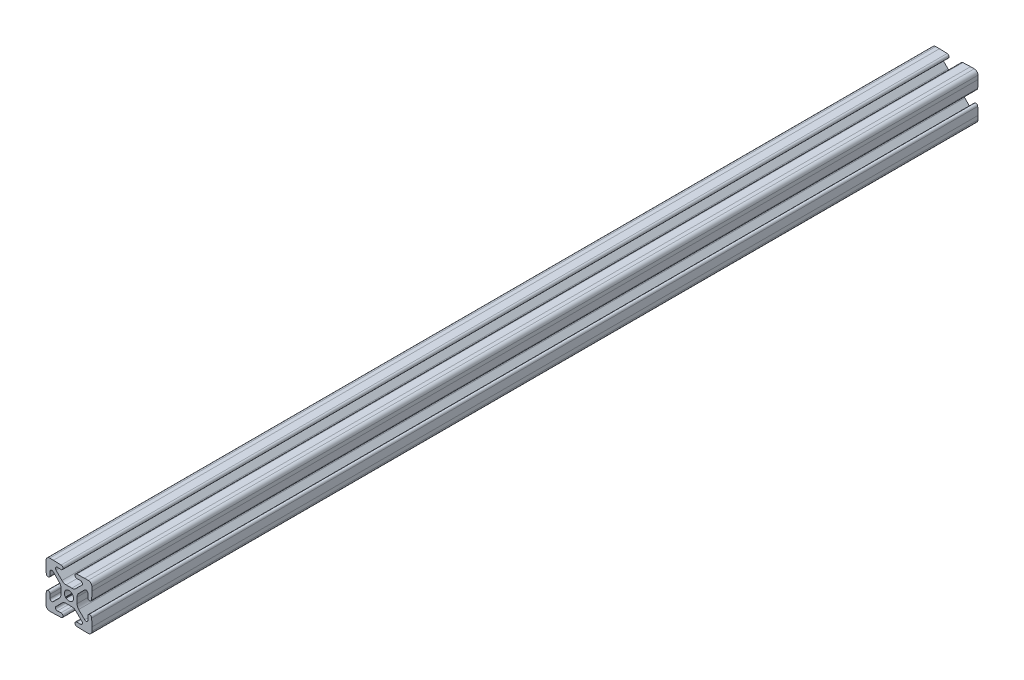
from build123d import *

# Parameters (mm, degrees)
BOSS_EXTRUDE1_DEPTH = 482.219


with BuildPart() as part:
    # Model → Boss-Extrude1 (new body)
    with BuildSketch(Plane.XY):
        with BuildLine():
            Line((50.659960212, 72.999871414), (53.774553856, 72.999871414))
            ThreePointArc((53.774553856, 72.999871414), (54.989573754, 72.758188929), (56.019617887, 72.069935444))
            Line((56.019617887, 72.069935444), (59.264200891, 68.825352439))
            ThreePointArc((59.264200891, 68.825352439), (59.477513437, 67.701802895), (58.510322513, 67.091550869))
            Line((58.510322513, 67.091550869), (56.572487817, 67.159221548))
            ThreePointArc((56.572487817, 67.159221548), (55.4691069, 66.130302197), (56.498026251, 65.026921279))
            Line((56.498026251, 65.026921279), (60.677257034, 64.880979325))
            Line((60.677257034, 64.880979325), (62.710657034, 64.880979325))
            ThreePointArc((62.710657034, 64.880979325), (64.129537501, 65.468698857), (64.717257034, 66.887579325))
            Line((64.717257034, 66.887579325), (64.717257034, 68.920979325))
            Line((64.717257034, 68.920979325), (64.57131508, 73.100210108))
            ThreePointArc((64.57131508, 73.100210108), (63.467934162, 74.129129459), (62.439014811, 73.025748542))
            Line((62.439014811, 73.025748542), (62.50668549, 71.087913846))
            ThreePointArc((62.50668549, 71.087913846), (61.896433464, 70.120722922), (60.77288392, 70.334035468))
            Line((60.77288392, 70.334035468), (57.528300915, 73.578618472))
            ThreePointArc((57.528300915, 73.578618472), (56.84004743, 74.608662605), (56.598364945, 75.823682503))
            Line((56.598364945, 75.823682503), (56.598364945, 78.938276147))
            ThreePointArc((56.598364945, 78.938276147), (56.84004743, 80.153296044), (57.528300915, 81.183340177))
            Line((57.528300915, 81.183340177), (60.77288392, 84.427923182))
            ThreePointArc((60.77288392, 84.427923182), (61.896433464, 84.641235728), (62.50668549, 83.674044803))
            Line((62.50668549, 83.674044803), (62.439014811, 81.736210108))
            ThreePointArc((62.439014811, 81.736210108), (63.467934162, 80.63282919), (64.57131508, 81.661748542))
            Line((64.57131508, 81.661748542), (64.717257034, 85.840979325))
            Line((64.717257034, 85.840979325), (64.717257034, 87.874379325))
            ThreePointArc((64.717257034, 87.874379325), (64.129537501, 89.293259792), (62.710657034, 89.880979325))
            Line((62.710657034, 89.880979325), (60.677257034, 89.880979325))
            Line((60.677257034, 89.880979325), (56.498026251, 89.73503737))
            ThreePointArc((56.498026251, 89.73503737), (55.4691069, 88.631656452), (56.572487817, 87.602737101))
            Line((56.572487817, 87.602737101), (58.510322513, 87.67040778))
            ThreePointArc((58.510322513, 87.67040778), (59.477513437, 87.060155754), (59.264200891, 85.93660621))
            Line((59.264200891, 85.93660621), (56.019617887, 82.692023205))
            ThreePointArc((56.019617887, 82.692023205), (54.989573754, 82.00376972), (53.774553856, 81.762087236))
            Line((53.774553856, 81.762087236), (50.659960212, 81.762087236))
            ThreePointArc((50.659960212, 81.762087236), (49.444940315, 82.00376972), (48.414896182, 82.692023205))
            Line((48.414896182, 82.692023205), (45.170313177, 85.93660621))
            ThreePointArc((45.170313177, 85.93660621), (44.957000631, 87.060155754), (45.924191556, 87.67040778))
            Line((45.924191556, 87.67040778), (47.862026251, 87.602737101))
            ThreePointArc((47.862026251, 87.602737101), (48.965407169, 88.631656452), (47.936487817, 89.73503737))
            Line((47.936487817, 89.73503737), (43.757257034, 89.880979325))
            Line((43.757257034, 89.880979325), (41.723857034, 89.880979325))
            ThreePointArc((41.723857034, 89.880979325), (40.304976567, 89.293259792), (39.717257034, 87.874379325))
            Line((39.717257034, 87.874379325), (39.717257034, 85.840979325))
            Line((39.717257034, 85.840979325), (39.863198989, 81.661748542))
            ThreePointArc((39.863198989, 81.661748542), (40.966579907, 80.63282919), (41.995499258, 81.736210108))
            Line((41.995499258, 81.736210108), (41.927828579, 83.674044803))
            ThreePointArc((41.927828579, 83.674044803), (42.538080605, 84.641235728), (43.661630149, 84.427923182))
            Line((43.661630149, 84.427923182), (46.906213154, 81.183340177))
            ThreePointArc((46.906213154, 81.183340177), (47.594466639, 80.153296044), (47.836149123, 78.938276147))
            Line((47.836149123, 78.938276147), (47.836149123, 75.823682503))
            ThreePointArc((47.836149123, 75.823682503), (47.594466639, 74.608662605), (46.906213154, 73.578618472))
            Line((46.906213154, 73.578618472), (43.661630149, 70.334035468))
            ThreePointArc((43.661630149, 70.334035468), (42.538080605, 70.120722922), (41.927828579, 71.087913846))
            Line((41.927828579, 71.087913846), (41.995499258, 73.025748542))
            ThreePointArc((41.995499258, 73.025748542), (40.966579907, 74.129129459), (39.863198989, 73.100210108))
            Line((39.863198989, 73.100210108), (39.717257034, 68.920979325))
            Line((39.717257034, 68.920979325), (39.717257034, 66.887579325))
            ThreePointArc((39.717257034, 66.887579325), (40.304976567, 65.468698857), (41.723857034, 64.880979325))
            Line((41.723857034, 64.880979325), (43.757257034, 64.880979325))
            Line((43.757257034, 64.880979325), (47.936487817, 65.026921279))
            ThreePointArc((47.936487817, 65.026921279), (48.965407169, 66.130302197), (47.862026251, 67.159221548))
            Line((47.862026251, 67.159221548), (45.924191556, 67.091550869))
            ThreePointArc((45.924191556, 67.091550869), (44.957000631, 67.701802895), (45.170313177, 68.825352439))
            Line((45.170313177, 68.825352439), (48.414896182, 72.069935444))
            ThreePointArc((48.414896182, 72.069935444), (49.444940315, 72.758188929), (50.659960212, 72.999871414))
        make_face()
        with BuildLine():
            Line((50.64953831, 75.433607249), (50.269884959, 75.433607249))
            Line((50.269884959, 75.433607249), (50.269884959, 75.8132606))
            ThreePointArc((50.269884959, 75.8132606), (53.985023987, 79.148746278), (50.64953831, 75.433607249))
        make_face(mode=Mode.SUBTRACT)
    extrude(amount=BOSS_EXTRUDE1_DEPTH)


solid = part.part
